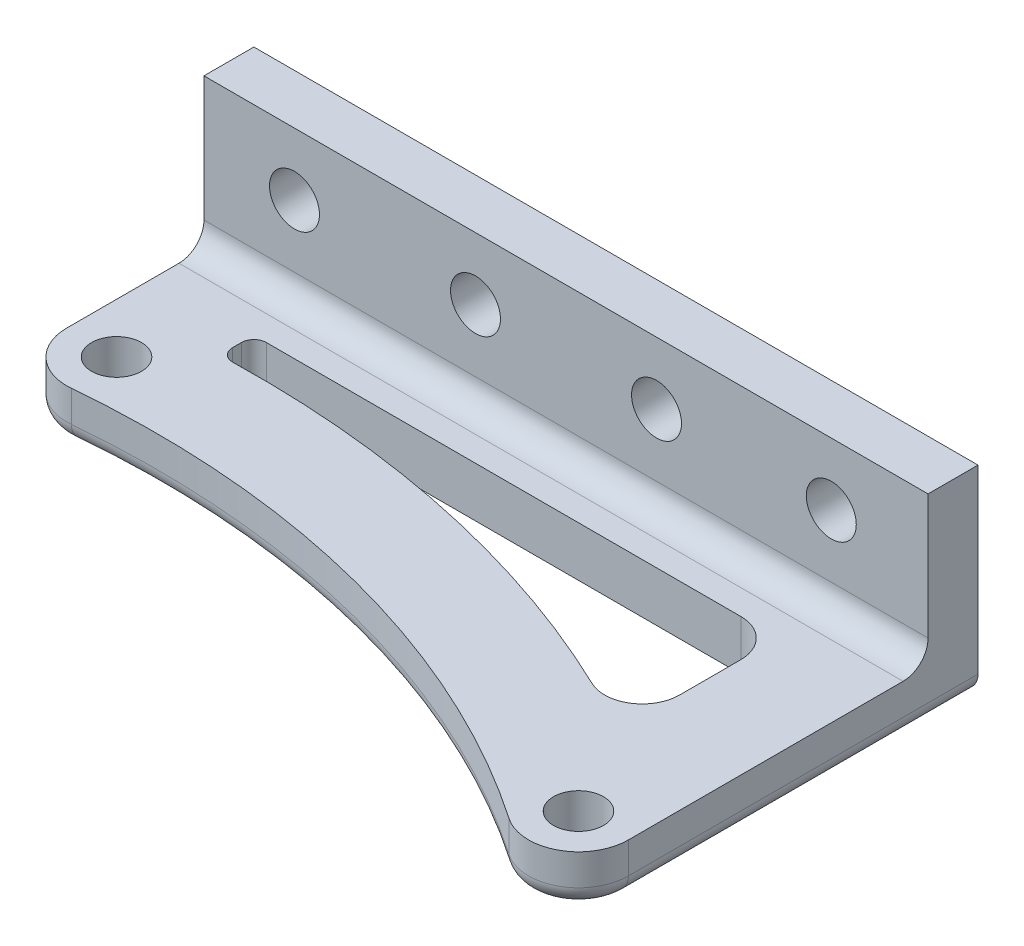
from build123d import *

# Parameters (mm, degrees)
SKETCH1_R           = 2
BOSS_EXTRUDE1_DEPTH = 4
SKETCH2_W           = 58
SKETCH2_H           = 4
BOSS_EXTRUDE2_DEPTH = 12
FILLET2_R           = 2
FILLET4_R           = 1.5
SKETCH4_R           = 2
CUT_EXTRUDE1_DEPTH  = 4


with BuildPart() as part:
    # Sketch1 → Boss-Extrude1 (new body)
    with BuildSketch(Plane(origin=(0, 0, 0), x_dir=(1, 0, 0), z_dir=(0, 1, 0))):
        with BuildLine():
            Line((-4, 13), (-4, 28))
            Line((-4, 28), (54, 28))
            Line((54, 28), (54, 0))
            ThreePointArc((54, 0), (51.867813839, -3.537127572), (47.744364269, -3.303347915))
            ThreePointArc((47.744364269, -3.303347915), (25.12511084, 6.98119554), (0.361009591, 9.016324301))
            ThreePointArc((0.361009591, 9.016324301), (-2.697773307, 10.046693517), (-4, 13))
        make_face()
        with Locations(Location((0, 13, 0), (0, 0, 270))):
            Circle(SKETCH1_R, mode=Mode.SUBTRACT)
        with Locations(Location((50, 0, 0), (0, 0, 270))):
            Circle(SKETCH1_R, mode=Mode.SUBTRACT)
        with BuildLine():
            Line((4, 18.289802574), (4, 19))
            ThreePointArc((4, 19), (4.292893219, 19.707106781), (5, 20))
            Line((5, 20), (25, 20))
            Line((25, 20), (43, 20))
            ThreePointArc((43, 20), (45.121320344, 19.121320344), (46, 17))
            Line((46, 17), (46, 12.096928721))
            ThreePointArc((46, 12.096928721), (44.597765919, 9.557806024), (41.701903954, 9.392312916))
            ThreePointArc((41.701903954, 9.392312916), (23.829546608, 15.509740284), (5.023311328, 17.29007432))
            ThreePointArc((5.023311328, 17.29007432), (4.301183618, 17.574501474), (4, 18.289802574))
        make_face(mode=Mode.SUBTRACT)
    extrude(amount=BOSS_EXTRUDE1_DEPTH)

    # Sketch2 → Boss-Extrude2 (add)
    with BuildSketch(Plane(origin=(0, 4, 0), x_dir=(1, 0, 0), z_dir=(0, 1, 0))):
        with Locations((25, 26)):
            Rectangle(SKETCH2_W, SKETCH2_H)
    extrude(amount=BOSS_EXTRUDE2_DEPTH)

    # Fillet2
    fillet2_edges = [part.edges().sort_by_distance(p)[0] for p in [
        (25, 4, -24),
    ]]
    fillet(fillet2_edges, radius=FILLET2_R)

    # Fillet4
    fillet4_edges = [part.edges().sort_by_distance(p)[0] for p in [
        (-4, 0, -20.5),
        (54, 0, -14),
        (51.867813839, 0, 3.537127572),
        (25.12511084, 0, -6.98119554),
        (-2.697773307, 0, -10.046693517),
    ]]
    fillet(fillet4_edges, radius=FILLET4_R)

    # Sketch4 → Cut-Extrude1 (cut)
    with BuildSketch(Plane.XY.offset(-24)):
        with Locations((17.75, 11)):
            Circle(SKETCH4_R)
        with Locations((32.25, 11)):
            Circle(SKETCH4_R)
        with Locations((46.25, 11)):
            Circle(SKETCH4_R)
        with Locations((3.25, 11)):
            Circle(SKETCH4_R)
    extrude(amount=-CUT_EXTRUDE1_DEPTH, mode=Mode.SUBTRACT)


solid = part.part
